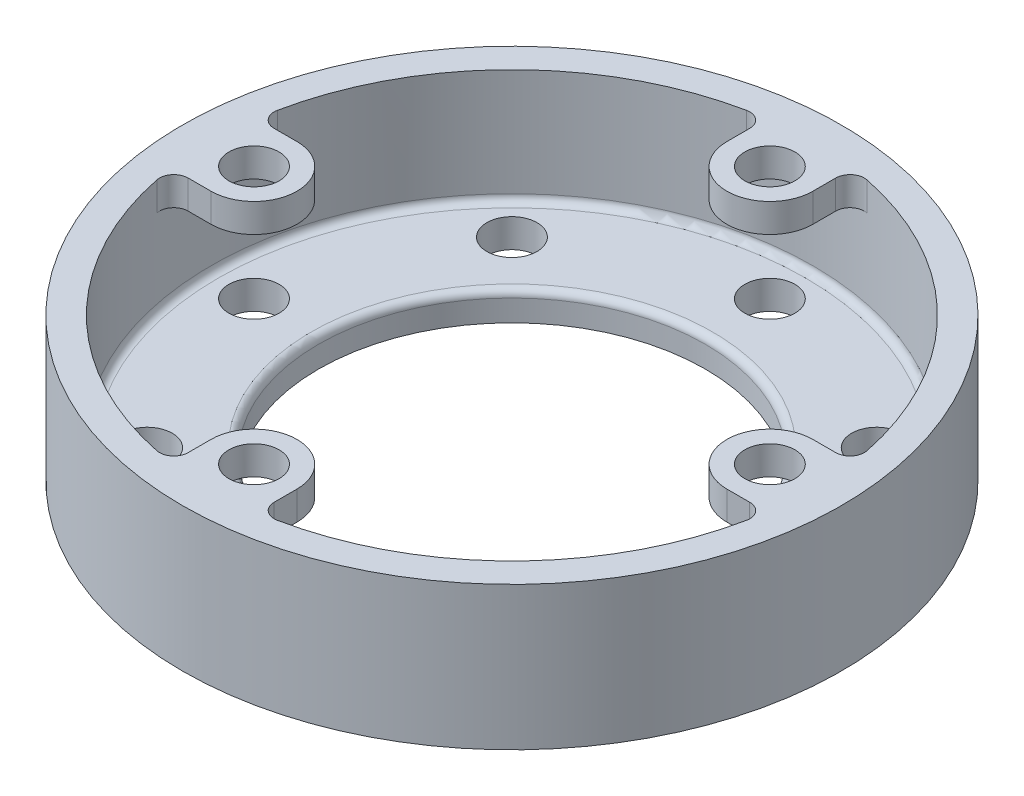
from build123d import *

# Parameters (mm, degrees)
SKETCH1_R                = 73.025
BASE_EXTRUDE_DEPTH       = 31.75
SHELL1_T                 = -6.35
SKETCH4_R                = 42.8625
CUT_EXTRUDE2_DEPTH       = 107.350652325
BOSS_EXTRUDE1_START      = -6.35
BOSS_EXTRUDE1_DEPTH      = 6.35
CUT_EXTRUDE1_REACH       = 110.043
SKETCH3_R                = 5.55625
FILLET1_R                = 3.175
CIRPATTERN1_COUNT        = 4
FILLET1_OF_CIRPATTERN1_R = 3.175
SKETCH5_R                = 5.55625
CUT_EXTRUDE3_DEPTH       = 107.350652325
CIRPATTERN2_COUNT        = 8
FILLET2_R                = 1.5875


with BuildPart() as part:
    # Sketch1 → Base-Extrude (new body)
    with BuildSketch(Plane(origin=(0, 0, 0), x_dir=(1, 0, 0), z_dir=(0, 1, 0))):
        with Locations(Location((0, 0, 0), (0, 0, 270))):
            Circle(SKETCH1_R)
    extrude(amount=BASE_EXTRUDE_DEPTH)

    # Shell1
    shell1_openings = [part.faces().sort_by_distance(p)[0] for p in [
        (0, 31.75, 0),
    ]]
    offset(amount=SHELL1_T, openings=shell1_openings, kind=Kind.INTERSECTION)

    # Sketch4 → Cut-Extrude2 (cut, through all)
    with BuildSketch(Plane(origin=(0, 6.35, 0), x_dir=(-1, 0, 0), z_dir=(0, 1, 0))):
        with Locations(Location((0, 0, 0), (0, 0, 90))):
            Circle(SKETCH4_R)
    extrude(amount=-CUT_EXTRUDE2_DEPTH, mode=Mode.SUBTRACT)

    # Sketch2 → Boss-Extrude1 (add)
    with BuildSketch(Plane(origin=(0, 31.75, 0), x_dir=(-1, 0, 0), z_dir=(0, 1, 0)).offset(BOSS_EXTRUDE1_START)):
        with BuildLine():
            Line((-9.525, -65.991135768), (-9.525, -57.15))
            ThreePointArc((-9.525, -57.15), (0, -47.625), (9.525, -57.15))
            Line((9.525, -57.15), (9.525, -65.991135768))
            ThreePointArc((9.525, -65.991135768), (0, -66.675), (-9.525, -65.991135768))
        make_face()
    boss_extrude1 = extrude(amount=BOSS_EXTRUDE1_DEPTH)

    # Sketch3 → Cut-Extrude1 (cut, up to next)
    with BuildSketch(Plane(origin=(0, 31.75, 0), x_dir=(-1, 0, 0), z_dir=(0, 1, 0)), mode=Mode.PRIVATE) as cut_extrude1_sk1:
        with Locations(Location((0, -57.15, 0), (0, 0, 90))):
            Circle(SKETCH3_R)
    cut_extrude1_tool1 = extrude(cut_extrude1_sk1.sketch, amount=-CUT_EXTRUDE1_REACH, mode=Mode.PRIVATE) & part.part
    cut_extrude1 = cut_extrude1_tool1.solids().sort_by_distance((0, 31.75, -57.15))[0]
    add(cut_extrude1, mode=Mode.SUBTRACT)

    # Fillet1
    fillet1_edges = [part.edges().sort_by_distance(p)[0] for p in [
        (-9.525, 28.575, -65.991135768),
        (9.525, 28.575, -65.991135768),
    ]]
    fillet(fillet1_edges, radius=FILLET1_R)

    # CirPattern1: Boss-Extrude1, Cut-Extrude1 ×4 about axis
    cirpattern1_axis = Axis((0, 0, 0), (0, 1, 0))
    add([boss_extrude1.rotate(cirpattern1_axis, i * 360 / CIRPATTERN1_COUNT) for i in range(1, CIRPATTERN1_COUNT)])
    add([cut_extrude1.rotate(cirpattern1_axis, i * 360 / CIRPATTERN1_COUNT) for i in range(1, CIRPATTERN1_COUNT)], mode=Mode.SUBTRACT)

    # Fillet1 of CirPattern1
    fillet1_of_cirpattern1_edges = [part.edges().sort_by_distance(p)[0] for p in [
        (-65.991135768, 28.575, 9.525),
        (-65.991135768, 28.575, -9.525),
        (9.525, 28.575, 65.991135768),
        (-9.525, 28.575, 65.991135768),
        (65.991135768, 28.575, -9.525),
        (65.991135768, 28.575, 9.525),
    ]]
    fillet(fillet1_of_cirpattern1_edges, radius=FILLET1_OF_CIRPATTERN1_R)

    # Sketch5 → Cut-Extrude3 (cut, through all)
    with BuildSketch(Plane(origin=(0, 6.35, 0), x_dir=(-1, 0, 0), z_dir=(0, 1, 0))):
        with Locations(Location((0, -57.15, 0), (0, 0, 90))):
            Circle(SKETCH5_R)
    cut_extrude3 = extrude(amount=-CUT_EXTRUDE3_DEPTH, mode=Mode.SUBTRACT)

    # CirPattern2: Cut-Extrude3 ×8 about axis
    cirpattern2_axis = Axis((0, 0, 0), (0, 1, 0))
    for i in range(1, CIRPATTERN2_COUNT):
        add(cut_extrude3.rotate(cirpattern2_axis, i * 360 / CIRPATTERN2_COUNT), mode=Mode.SUBTRACT)

    # Fillet2
    fillet2_edges = [part.edges().sort_by_distance(p)[0] for p in [
        (0, 6.35, -42.8625),
        (0, 6.35, -66.675),
    ]]
    fillet(fillet2_edges, radius=FILLET2_R)


solid = part.part
